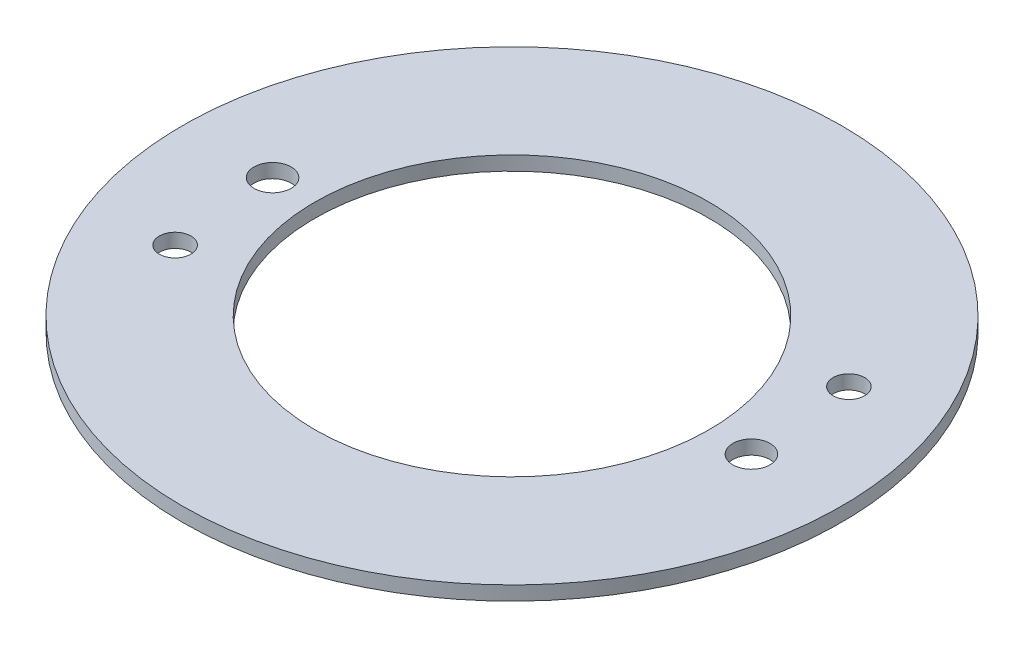
from build123d import *

# Parameters (mm, degrees)
SKETCH1_R           = 74.295
BOSS_EXTRUDE1_DEPTH = 3.175
SKETCH2_R           = 3.556
SKETCH2_R_2         = 4.191
CUT_EXTRUDE1_DEPTH  = 3.175
SKETCH3_R           = 44.45
CUT_EXTRUDE2_DEPTH  = 3.175


with BuildPart() as part:
    # Sketch1 → Boss-Extrude1 (new body)
    with BuildSketch(Plane(origin=(0, 0, 0), x_dir=(1, 0, 0), z_dir=(0, 1, 0))):
        with Locations(Location((0, 0, 0), (0, 0, 270))):
            Circle(SKETCH1_R)
    extrude(amount=BOSS_EXTRUDE1_DEPTH)

    # Sketch2 → Cut-Extrude1 (cut)
    with BuildSketch(Plane(origin=(0, 3.175, 0), x_dir=(1, 0, 0), z_dir=(0, 1, 0))):
        with Locations(Location((-51.795490029, -24.152633658, 0), (0, 0, 270))):
            Circle(SKETCH2_R)
        with Locations(Location((51.795490029, 24.152633658, 0), (0, 0, 270))):
            Circle(SKETCH2_R)
        with Locations(Location((-53.975, 0, 0), (0, 0, 270))):
            Circle(SKETCH2_R_2)
        with Locations(Location((53.975, 0, 0), (0, 0, 270))):
            Circle(SKETCH2_R_2)
    extrude(amount=-CUT_EXTRUDE1_DEPTH, mode=Mode.SUBTRACT)

    # Sketch3 → Cut-Extrude2 (cut)
    with BuildSketch(Plane(origin=(0, 3.175, 0), x_dir=(1, 0, 0), z_dir=(0, 1, 0))):
        with Locations(Location((0, 0, 0), (0, 0, 270))):
            Circle(SKETCH3_R)
    extrude(amount=-CUT_EXTRUDE2_DEPTH, mode=Mode.SUBTRACT)


solid = part.part
